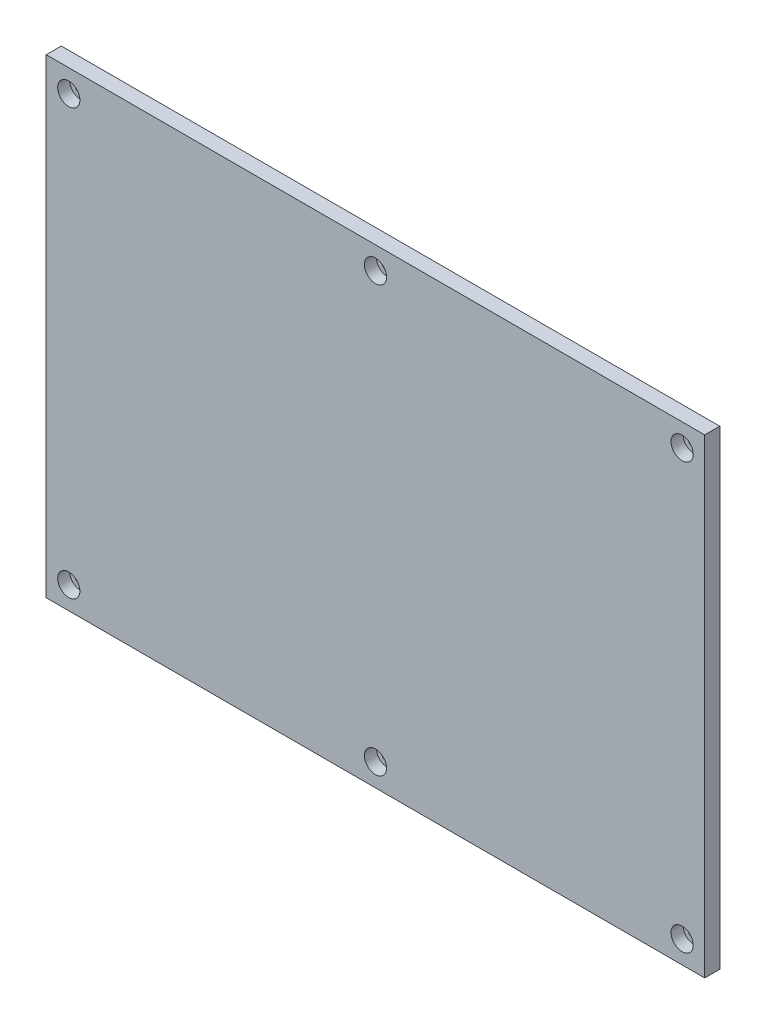
from build123d import *

# Parameters (mm, degrees)
SKETCH1_W           = 175
SKETCH1_H           = 125
BOSS_EXTRUDE1_DEPTH = 4
SKETCH2_R           = 2.95
CUT_EXTRUDE1_DEPTH  = 3.2
SKETCH3_R           = 1.7
CUT_EXTRUDE2_DEPTH  = 3.2


with BuildPart() as part:
    # Sketch1 → Boss-Extrude1 (new body)
    with BuildSketch(Plane.XY):
        with Locations((87.5, 62.5)):
            Rectangle(SKETCH1_W, SKETCH1_H)
    extrude(amount=BOSS_EXTRUDE1_DEPTH)

    # Sketch2 → Cut-Extrude1 (cut)
    with BuildSketch(Plane.XY.offset(4)):
        with Locations((6, 119)):
            Circle(SKETCH2_R)
        with Locations((169, 119)):
            Circle(SKETCH2_R)
        with Locations((6, 6)):
            Circle(SKETCH2_R)
        with Locations((169, 6)):
            Circle(SKETCH2_R)
        with Locations((87.5, 119)):
            Circle(SKETCH2_R)
        with Locations((87.5, 6)):
            Circle(SKETCH2_R)
    extrude(amount=-CUT_EXTRUDE1_DEPTH, mode=Mode.SUBTRACT)

    # Sketch3 → Cut-Extrude2 (cut)
    with BuildSketch(Plane.XY.offset(0.8)):
        with Locations((6, 119)):
            Circle(SKETCH3_R)
        with Locations((87.5, 119)):
            Circle(SKETCH3_R)
        with Locations((169, 119)):
            Circle(SKETCH3_R)
        with Locations((169, 6)):
            Circle(SKETCH3_R)
        with Locations((87.5, 6)):
            Circle(SKETCH3_R)
        with Locations((6, 6)):
            Circle(SKETCH3_R)
    extrude(amount=-CUT_EXTRUDE2_DEPTH, mode=Mode.SUBTRACT)


solid = part.part
